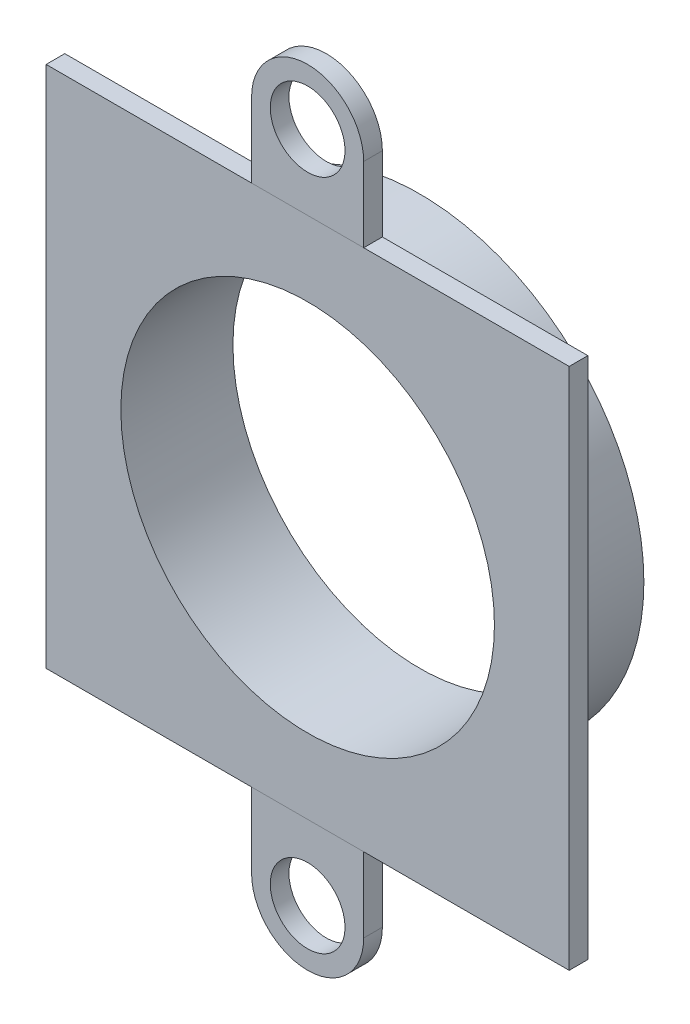
from build123d import *
from build123d.topology import SkipClean

# Parameters (mm, degrees)
SKETCH_2_W          = 14
SKETCH_2_H          = 14
SKETCH_2_R          = 5
EXTRUDE_1_DEPTH     = 0.5
SKETCH_3_W          = 3
SKETCH_3_H          = 0.5
EXTRUDE_2_DEPTH     = 3.5
CUT_EXTRUDE_1_DEPTH = 4
SKETCH_5_R          = 1
CUT_EXTRUDE_2_DEPTH = 4
EXTRUDE_START       = 2.5
SKETCH_6_R          = 6
SKETCH_6_R_2        = 5
EXTRUDE_3_DEPTH     = 2.5


with BuildPart() as part:
    # 草图2 → 凸台-拉伸1 (new body)
    with BuildSketch(Plane.XY):
        Rectangle(SKETCH_2_W, SKETCH_2_H)
        Circle(SKETCH_2_R, mode=Mode.SUBTRACT)
    extrude(amount=EXTRUDE_1_DEPTH)

    # 草图6 → 凸台-拉伸3 (add)
    with SkipClean():  # the faces are left unmerged after this step: merging them gives an invalid solid
        with BuildSketch(Plane(origin=(0, 0, 0), x_dir=(-1, 0, 0), z_dir=(0, 0, -1)).offset(EXTRUDE_START)):
            with Locations(Location((0, 0, 0), (0, 0, 180))):
                Circle(SKETCH_6_R)
            Circle(SKETCH_6_R_2, mode=Mode.SUBTRACT)
        extrude(amount=-EXTRUDE_3_DEPTH)


with BuildPart() as body_2:
    # 草图3 → 凸台-拉伸2 (new body)
    with BuildSketch(Plane.XZ.offset(7)):
        with Locations((0, 0.25)):
            Rectangle(SKETCH_3_W, SKETCH_3_H)
    extrude(amount=EXTRUDE_2_DEPTH)

    # 草图4 → 切除-拉伸1 (cut)
    with BuildSketch(Plane(origin=(0, 0, 0), x_dir=(-1, 0, 0), z_dir=(0, 0, -1))):
        with BuildLine():
            Line((1.5, -10.5), (1.5, -9))
            ThreePointArc((1.5, -9), (1.060660172, -10.060660172), (0, -10.5))
            Line((0, -10.5), (1.5, -10.5))
        make_face()
        with BuildLine():
            ThreePointArc((0, -10.5), (-1.060660172, -10.060660172), (-1.5, -9))
            Line((-1.5, -9), (-1.5, -10.5))
            Line((-1.5, -10.5), (0, -10.5))
        make_face()
    extrude(amount=-CUT_EXTRUDE_1_DEPTH, mode=Mode.SUBTRACT)

    # 草图5 → 切除-拉伸2 (cut)
    with BuildSketch(Plane(origin=(0, 0, 0), x_dir=(-1, 0, 0), z_dir=(0, 0, -1))):
        with Locations((0, -9)):
            Circle(SKETCH_5_R)
    extrude(amount=-CUT_EXTRUDE_2_DEPTH, mode=Mode.SUBTRACT)


with BuildPart() as body_3:
    # 镜向7: mirrored copy
    add(body_2.part.mirror(Plane.ZX))


solid = Compound([part.part, body_2.part, body_3.part])
